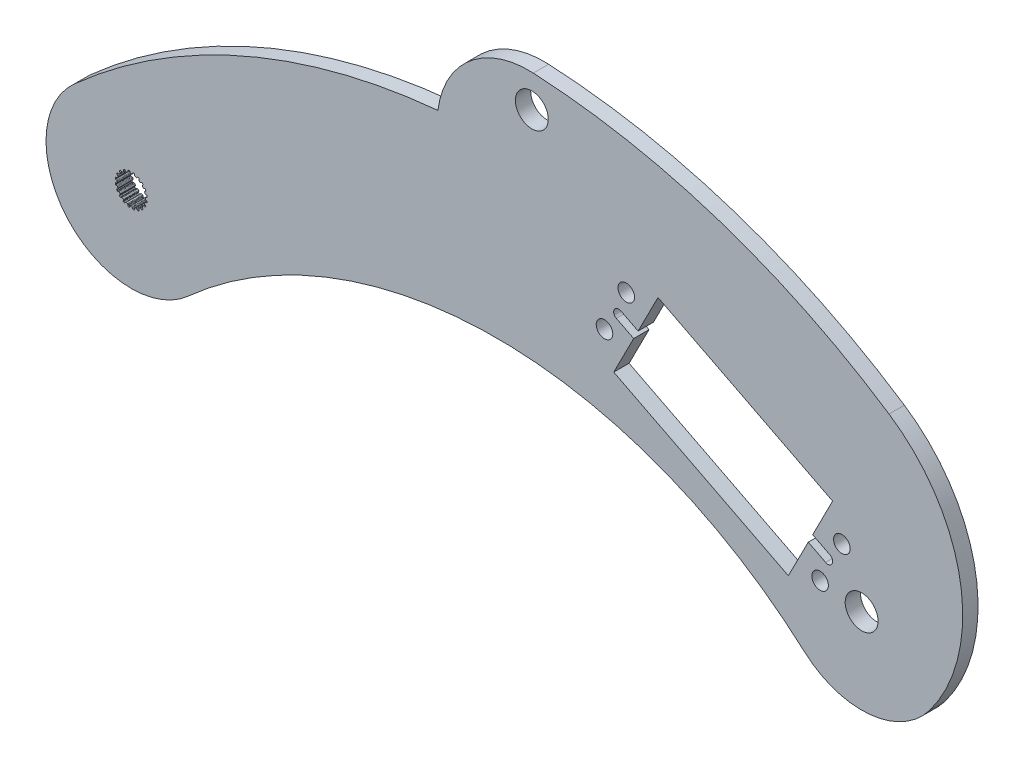
from build123d import *

# Parameters (mm, degrees)
BOSS_EXTRUDE1_DEPTH = 3.2004
SKETCH2_R           = 1.7272
SKETCH2_R_2         = 3.429
CUT_EXTRUDE1_DEPTH  = 3.2004
CUT_EXTRUDE2_DEPTH  = 3.2004
BOSS_EXTRUDE2_START = -3.2004
SKETCH4_R           = 3.429
BOSS_EXTRUDE2_DEPTH = 3.2004


with BuildPart() as part:
    # Sketch1 → Boss-Extrude1 (new body)
    with BuildSketch(Plane.XY):
        with BuildLine():
            ThreePointArc((-11.875315661, 13.236894431), (76.2, 46.954576728), (164.275315661, 13.236894431))
            ThreePointArc((164.275315661, 13.236894431), (165.636894431, -11.875315661), (140.524684339, -13.236894431))
            ThreePointArc((140.524684339, -13.236894431), (76.2, 11.388385128), (11.875315661, -13.236894431))
            ThreePointArc((11.875315661, -13.236894431), (-13.236894431, -11.875315661), (-11.875315661, 13.236894431))
        make_face()
        with BuildLine():
            Line((-0.106949245, 2.969874934), (0.106949245, 2.969874934))
            ThreePointArc((0.106949245, 2.969874934), (0.196343213, 2.986924176), (0.253739238, 3.057547504))
            Line((0.253739238, 3.057547504), (0.315888147, 3.237526941))
            ThreePointArc((0.315888147, 3.237526941), (0.359032156, 3.298322911), (0.4281449, 3.326269005))
            Line((0.4281449, 3.326269005), (0.620027588, 3.2937547))
            ThreePointArc((0.620027588, 3.2937547), (0.689621142, 3.24802576), (0.718272212, 3.169836791))
            Line((0.718272212, 3.169836791), (0.724389167, 2.979527391))
            ThreePointArc((0.724389167, 2.979527391), (0.750934762, 2.9040661), (0.816027049, 2.857568043))
            Line((0.816027049, 2.857568043), (1.019456602, 2.791469774))
            ThreePointArc((1.019456602, 2.791469774), (1.109743823, 2.780060312), (1.186154496, 2.829490741))
            Line((1.186154496, 2.829490741), (1.300878326, 2.981456288))
            ThreePointArc((1.300878326, 2.981456288), (1.360697704, 3.02594446), (1.435063648, 3.031165762))
            Line((1.435063648, 3.031165762), (1.607507455, 2.940947809))
            ThreePointArc((1.607507455, 2.940947809), (1.659563839, 2.875951412), (1.662650905, 2.792735615))
            Line((1.662650905, 2.792735615), (1.609659636, 2.609850378))
            ThreePointArc((1.609659636, 2.609850378), (1.611587176, 2.529879385), (1.659124931, 2.465542482))
            Line((1.659124931, 2.465542482), (1.832172444, 2.339816104))
            ThreePointArc((1.832172444, 2.339816104), (1.914514976, 2.301064775), (2.002460687, 2.32446371))
            Line((2.002460687, 2.32446371), (2.158529469, 2.433539921))
            ThreePointArc((2.158529469, 2.433539921), (2.229168681, 2.457365482), (2.301508367, 2.439350895))
            Line((2.301508367, 2.439350895), (2.437633293, 2.300260456))
            ThreePointArc((2.437633293, 2.300260456), (2.467056864, 2.222358901), (2.444277744, 2.14226202))
            Line((2.444277744, 2.14226202), (2.337365406, 1.984703026))
            ThreePointArc((2.337365406, 1.984703026), (2.314486209, 1.908050449), (2.339816104, 1.832172444))
            Line((2.339816104, 1.832172444), (2.465542482, 1.659124931))
            ThreePointArc((2.465542482, 1.659124931), (2.531880064, 1.596824985), (2.622752074, 1.591901975))
            Line((2.622752074, 1.591901975), (2.804888709, 1.64741171))
            ThreePointArc((2.804888709, 1.64741171), (2.879433095, 1.648242449), (2.942665411, 1.608755366))
            Line((2.942665411, 1.608755366), (3.0291466, 1.434407582))
            ThreePointArc((3.0291466, 1.434407582), (3.033057175, 1.351226417), (2.986641646, 1.282088892))
            Line((2.986641646, 1.282088892), (2.836273564, 1.165279113))
            ThreePointArc((2.836273564, 1.165279113), (2.790827206, 1.099448241), (2.791469774, 1.019456602))
            Line((2.791469774, 1.019456602), (2.857568043, 0.816027049))
            ThreePointArc((2.857568043, 0.816027049), (2.901407091, 0.736276839), (2.986310214, 0.703513784))
            Line((2.986310214, 0.703513784), (3.1766859, 0.700023363))
            ThreePointArc((3.1766859, 0.700023363), (3.247838536, 0.677777961), (3.295773863, 0.620683653))
            Line((3.295773863, 0.620683653), (3.324145932, 0.4281449))
            ThreePointArc((3.324145932, 0.4281449), (3.302160717, 0.347826477), (3.236652255, 0.29641597))
            Line((3.236652255, 0.29641597), (3.057547504, 0.231789562))
            ThreePointArc((3.057547504, 0.231789562), (2.993982591, 0.183224379), (2.969874934, 0.106949245))
            Line((2.969874934, 0.106949245), (2.969874934, -0.106949245))
            ThreePointArc((2.969874934, -0.106949245), (2.986924176, -0.196343213), (3.057547504, -0.253739238))
            Line((3.057547504, -0.253739238), (3.237526941, -0.315888147))
            ThreePointArc((3.237526941, -0.315888147), (3.298322911, -0.359032156), (3.326269005, -0.4281449))
            Line((3.326269005, -0.4281449), (3.2937547, -0.620027588))
            ThreePointArc((3.2937547, -0.620027588), (3.24802576, -0.689621142), (3.169836791, -0.718272212))
            Line((3.169836791, -0.718272212), (2.979527391, -0.724389167))
            ThreePointArc((2.979527391, -0.724389167), (2.9040661, -0.750934762), (2.857568043, -0.816027049))
            Line((2.857568043, -0.816027049), (2.791469774, -1.019456602))
            ThreePointArc((2.791469774, -1.019456602), (2.780060312, -1.109743823), (2.829490741, -1.186154496))
            Line((2.829490741, -1.186154496), (2.981456288, -1.300878326))
            ThreePointArc((2.981456288, -1.300878326), (3.02594446, -1.360697704), (3.031165762, -1.435063648))
            Line((3.031165762, -1.435063648), (2.940947809, -1.607507455))
            ThreePointArc((2.940947809, -1.607507455), (2.875951412, -1.659563839), (2.792735615, -1.662650905))
            Line((2.792735615, -1.662650905), (2.609850378, -1.609659636))
            ThreePointArc((2.609850378, -1.609659636), (2.529879385, -1.611587176), (2.465542482, -1.659124931))
            Line((2.465542482, -1.659124931), (2.339816104, -1.832172444))
            ThreePointArc((2.339816104, -1.832172444), (2.301064775, -1.914514976), (2.32446371, -2.002460687))
            Line((2.32446371, -2.002460687), (2.433539921, -2.158529469))
            ThreePointArc((2.433539921, -2.158529469), (2.457365482, -2.229168681), (2.439350895, -2.301508367))
            Line((2.439350895, -2.301508367), (2.300260456, -2.437633293))
            ThreePointArc((2.300260456, -2.437633293), (2.222358901, -2.467056864), (2.14226202, -2.444277744))
            Line((2.14226202, -2.444277744), (1.984703026, -2.337365406))
            ThreePointArc((1.984703026, -2.337365406), (1.908050449, -2.314486209), (1.832172444, -2.339816104))
            Line((1.832172444, -2.339816104), (1.659124931, -2.465542482))
            ThreePointArc((1.659124931, -2.465542482), (1.596824985, -2.531880064), (1.591901975, -2.622752074))
            Line((1.591901975, -2.622752074), (1.64741171, -2.804888709))
            ThreePointArc((1.64741171, -2.804888709), (1.648242449, -2.879433095), (1.608755366, -2.942665411))
            Line((1.608755366, -2.942665411), (1.434407582, -3.0291466))
            ThreePointArc((1.434407582, -3.0291466), (1.351226417, -3.033057175), (1.282088892, -2.986641646))
            Line((1.282088892, -2.986641646), (1.165279113, -2.836273564))
            ThreePointArc((1.165279113, -2.836273564), (1.099448241, -2.790827206), (1.019456602, -2.791469774))
            Line((1.019456602, -2.791469774), (0.816027049, -2.857568043))
            ThreePointArc((0.816027049, -2.857568043), (0.736276839, -2.901407091), (0.703513784, -2.986310214))
            Line((0.703513784, -2.986310214), (0.700023363, -3.1766859))
            ThreePointArc((0.700023363, -3.1766859), (0.677777961, -3.247838536), (0.620683653, -3.295773863))
            Line((0.620683653, -3.295773863), (0.4281449, -3.324145932))
            ThreePointArc((0.4281449, -3.324145932), (0.347826477, -3.302160717), (0.29641597, -3.236652255))
            Line((0.29641597, -3.236652255), (0.231789562, -3.057547504))
            ThreePointArc((0.231789562, -3.057547504), (0.183224379, -2.993982591), (0.106949245, -2.969874934))
            Line((0.106949245, -2.969874934), (-0.106949245, -2.969874934))
            ThreePointArc((-0.106949245, -2.969874934), (-0.196343213, -2.986924176), (-0.253739238, -3.057547504))
            Line((-0.253739238, -3.057547504), (-0.315888147, -3.237526941))
            ThreePointArc((-0.315888147, -3.237526941), (-0.359032156, -3.298322911), (-0.4281449, -3.326269005))
            Line((-0.4281449, -3.326269005), (-0.620027588, -3.2937547))
            ThreePointArc((-0.620027588, -3.2937547), (-0.689621142, -3.24802576), (-0.718272212, -3.169836791))
            Line((-0.718272212, -3.169836791), (-0.724389167, -2.979527391))
            ThreePointArc((-0.724389167, -2.979527391), (-0.750934762, -2.9040661), (-0.816027049, -2.857568043))
            Line((-0.816027049, -2.857568043), (-1.019456602, -2.791469774))
            ThreePointArc((-1.019456602, -2.791469774), (-1.109743823, -2.780060312), (-1.186154496, -2.829490741))
            Line((-1.186154496, -2.829490741), (-1.300878326, -2.981456288))
            ThreePointArc((-1.300878326, -2.981456288), (-1.360697704, -3.02594446), (-1.435063648, -3.031165762))
            Line((-1.435063648, -3.031165762), (-1.607507455, -2.940947809))
            ThreePointArc((-1.607507455, -2.940947809), (-1.659563839, -2.875951412), (-1.662650905, -2.792735615))
            Line((-1.662650905, -2.792735615), (-1.609659636, -2.609850378))
            ThreePointArc((-1.609659636, -2.609850378), (-1.611587176, -2.529879385), (-1.659124931, -2.465542482))
            Line((-1.659124931, -2.465542482), (-1.832172444, -2.339816104))
            ThreePointArc((-1.832172444, -2.339816104), (-1.914514976, -2.301064775), (-2.002460687, -2.32446371))
            Line((-2.002460687, -2.32446371), (-2.158529469, -2.433539921))
            ThreePointArc((-2.158529469, -2.433539921), (-2.229168681, -2.457365482), (-2.301508367, -2.439350895))
            Line((-2.301508367, -2.439350895), (-2.437633293, -2.300260456))
            ThreePointArc((-2.437633293, -2.300260456), (-2.467056864, -2.222358901), (-2.444277744, -2.14226202))
            Line((-2.444277744, -2.14226202), (-2.337365406, -1.984703026))
            ThreePointArc((-2.337365406, -1.984703026), (-2.314486209, -1.908050449), (-2.339816104, -1.832172444))
            Line((-2.339816104, -1.832172444), (-2.465542482, -1.659124931))
            ThreePointArc((-2.465542482, -1.659124931), (-2.531880064, -1.596824985), (-2.622752074, -1.591901975))
            Line((-2.622752074, -1.591901975), (-2.804888709, -1.64741171))
            ThreePointArc((-2.804888709, -1.64741171), (-2.879433095, -1.648242449), (-2.942665411, -1.608755366))
            Line((-2.942665411, -1.608755366), (-3.0291466, -1.434407582))
            ThreePointArc((-3.0291466, -1.434407582), (-3.033057175, -1.351226417), (-2.986641646, -1.282088892))
            Line((-2.986641646, -1.282088892), (-2.836273564, -1.165279113))
            ThreePointArc((-2.836273564, -1.165279113), (-2.790827206, -1.099448241), (-2.791469774, -1.019456602))
            Line((-2.791469774, -1.019456602), (-2.857568043, -0.816027049))
            ThreePointArc((-2.857568043, -0.816027049), (-2.901407091, -0.736276839), (-2.986310214, -0.703513784))
            Line((-2.986310214, -0.703513784), (-3.1766859, -0.700023363))
            ThreePointArc((-3.1766859, -0.700023363), (-3.247838536, -0.677777961), (-3.295773863, -0.620683653))
            Line((-3.295773863, -0.620683653), (-3.324145932, -0.4281449))
            ThreePointArc((-3.324145932, -0.4281449), (-3.302160717, -0.347826477), (-3.236652255, -0.29641597))
            Line((-3.236652255, -0.29641597), (-3.057547504, -0.231789562))
            ThreePointArc((-3.057547504, -0.231789562), (-2.993982591, -0.183224379), (-2.969874934, -0.106949245))
            Line((-2.969874934, -0.106949245), (-2.969874934, 0.106949245))
            ThreePointArc((-2.969874934, 0.106949245), (-2.986924176, 0.196343213), (-3.057547504, 0.253739238))
            Line((-3.057547504, 0.253739238), (-3.237526941, 0.315888147))
            ThreePointArc((-3.237526941, 0.315888147), (-3.298322911, 0.359032156), (-3.326269005, 0.4281449))
            Line((-3.326269005, 0.4281449), (-3.2937547, 0.620027588))
            ThreePointArc((-3.2937547, 0.620027588), (-3.24802576, 0.689621142), (-3.169836791, 0.718272212))
            Line((-3.169836791, 0.718272212), (-2.979527391, 0.724389167))
            ThreePointArc((-2.979527391, 0.724389167), (-2.9040661, 0.750934762), (-2.857568043, 0.816027049))
            Line((-2.857568043, 0.816027049), (-2.791469774, 1.019456602))
            ThreePointArc((-2.791469774, 1.019456602), (-2.780060312, 1.109743823), (-2.829490741, 1.186154496))
            Line((-2.829490741, 1.186154496), (-2.981456288, 1.300878326))
            ThreePointArc((-2.981456288, 1.300878326), (-3.02594446, 1.360697704), (-3.031165762, 1.435063648))
            Line((-3.031165762, 1.435063648), (-2.940947809, 1.607507455))
            ThreePointArc((-2.940947809, 1.607507455), (-2.875951412, 1.659563839), (-2.792735615, 1.662650905))
            Line((-2.792735615, 1.662650905), (-2.609850378, 1.609659636))
            ThreePointArc((-2.609850378, 1.609659636), (-2.529879385, 1.611587176), (-2.465542482, 1.659124931))
            Line((-2.465542482, 1.659124931), (-2.339816104, 1.832172444))
            ThreePointArc((-2.339816104, 1.832172444), (-2.301064775, 1.914514976), (-2.32446371, 2.002460687))
            Line((-2.32446371, 2.002460687), (-2.433539921, 2.158529469))
            ThreePointArc((-2.433539921, 2.158529469), (-2.457365482, 2.229168681), (-2.439350895, 2.301508367))
            Line((-2.439350895, 2.301508367), (-2.300260456, 2.437633293))
            ThreePointArc((-2.300260456, 2.437633293), (-2.222358901, 2.467056864), (-2.14226202, 2.444277744))
            Line((-2.14226202, 2.444277744), (-1.984703026, 2.337365406))
            ThreePointArc((-1.984703026, 2.337365406), (-1.908050449, 2.314486209), (-1.832172444, 2.339816104))
            Line((-1.832172444, 2.339816104), (-1.659124931, 2.465542482))
            ThreePointArc((-1.659124931, 2.465542482), (-1.596824985, 2.531880064), (-1.591901975, 2.622752074))
            Line((-1.591901975, 2.622752074), (-1.64741171, 2.804888709))
            ThreePointArc((-1.64741171, 2.804888709), (-1.648242449, 2.879433095), (-1.608755366, 2.942665411))
            Line((-1.608755366, 2.942665411), (-1.434407582, 3.0291466))
            ThreePointArc((-1.434407582, 3.0291466), (-1.351226417, 3.033057175), (-1.282088892, 2.986641646))
            Line((-1.282088892, 2.986641646), (-1.165279113, 2.836273564))
            ThreePointArc((-1.165279113, 2.836273564), (-1.099448241, 2.790827206), (-1.019456602, 2.791469774))
            Line((-1.019456602, 2.791469774), (-0.816027049, 2.857568043))
            ThreePointArc((-0.816027049, 2.857568043), (-0.736276839, 2.901407091), (-0.703513784, 2.986310214))
            Line((-0.703513784, 2.986310214), (-0.700023363, 3.1766859))
            ThreePointArc((-0.700023363, 3.1766859), (-0.677777961, 3.247838536), (-0.620683653, 3.295773863))
            Line((-0.620683653, 3.295773863), (-0.4281449, 3.324145932))
            ThreePointArc((-0.4281449, 3.324145932), (-0.347826477, 3.302160717), (-0.29641597, 3.236652255))
            Line((-0.29641597, 3.236652255), (-0.231789562, 3.057547504))
            ThreePointArc((-0.231789562, 3.057547504), (-0.183224379, 2.993982591), (-0.106949245, 2.969874934))
        make_face(mode=Mode.SUBTRACT)
    extrude(amount=BOSS_EXTRUDE1_DEPTH)

    # Sketch2 → Cut-Extrude1 (cut)
    with BuildSketch(Plane.XY.offset(3.2004)):
        with Locations((103.294155033, 33.130546269)):
            Circle(SKETCH2_R)
        with Locations((143.733546084, 1.272962356)):
            Circle(SKETCH2_R)
        with Locations((148.278076154, 10.180669567)):
            Circle(SKETCH2_R)
        with Locations((98.749624963, 24.222839057)):
            Circle(SKETCH2_R)
        with Locations((152.4, 0)):
            Circle(SKETCH2_R_2)
        Polygon((109.917504264, 35.544185352), (146.344681894, 16.959784207), (137.110196853, -1.140676727), (100.683019223, 17.443724418), align=None)
    extrude(amount=-CUT_EXTRUDE1_DEPTH, mode=Mode.SUBTRACT)

    # Sketch3 → Cut-Extrude2 (cut)
    with BuildSketch(Plane.XY.offset(3.2004)):
        with BuildLine():
            Line((102.141893809, 29.24587494), (105.761985996, 27.398977932))
            Line((105.761985996, 27.398977932), (104.838537492, 25.588931838))
            Line((104.838537492, 25.588931838), (101.218445305, 27.435828846))
            ThreePointArc((101.218445305, 27.435828846), (100.77514651, 28.802576145), (102.141893809, 29.24587494))
        make_face()
        with BuildLine():
            Line((142.189163626, 8.814576786), (145.809255813, 6.967679778))
            ThreePointArc((145.809255813, 6.967679778), (146.252554607, 5.60093248), (144.885807308, 5.157633685))
            Line((144.885807308, 5.157633685), (141.265715122, 7.004530693))
            Line((141.265715122, 7.004530693), (142.189163626, 8.814576786))
        make_face()
    extrude(amount=-CUT_EXTRUDE2_DEPTH, mode=Mode.SUBTRACT)

    # Sketch4 → Boss-Extrude2 (add)
    with BuildSketch(Plane.XY.offset(3.2004).offset(BOSS_EXTRUDE2_START)):
        with BuildLine():
            ThreePointArc((63.994452175, 46.388596865), (70.655775204, 58.652872993), (83.889992464, 63.08471087))
            ThreePointArc((83.889992464, 63.08471087), (122.650665385, 55.817735997), (158.123143389, 38.586891754))
            ThreePointArc((158.123143389, 38.586891754), (172.994139846, 15.795725761), (166.631162232, -10.663607165))
            ThreePointArc((166.631162232, -10.663607165), (170.097331469, 1.744406806), (164.275315661, 13.236894431))
            ThreePointArc((164.275315661, 13.236894431), (117.598239835, 40.289080087), (63.994452175, 46.388596865))
        make_face()
        with Locations((83.588077125, 56.286137461)):
            Circle(SKETCH4_R, mode=Mode.SUBTRACT)
    extrude(amount=BOSS_EXTRUDE2_DEPTH)


solid = part.part
